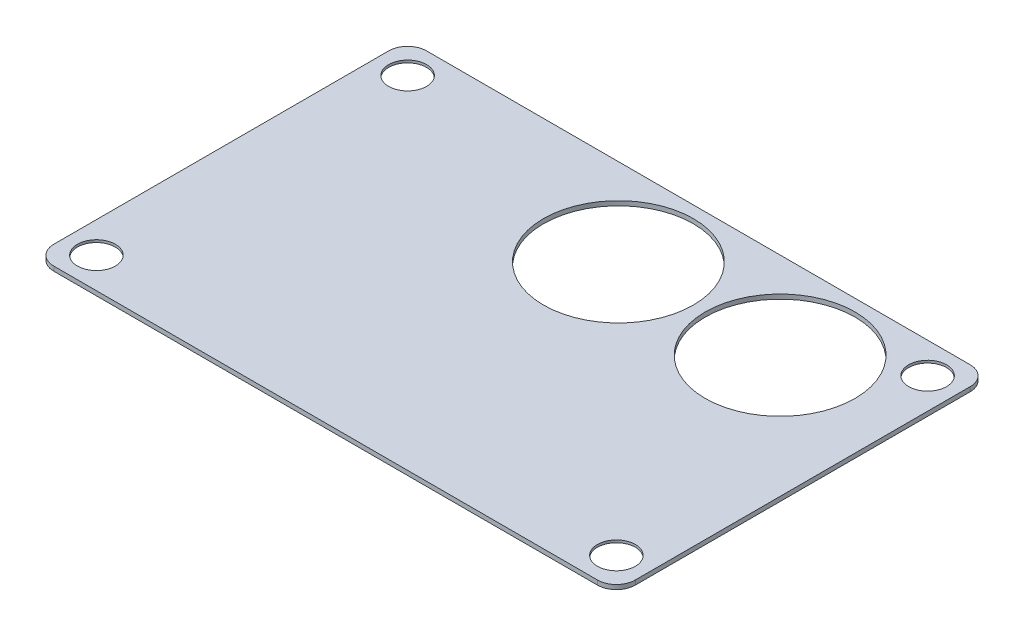
from build123d import *

# Parameters (mm, degrees)
SKETCH1_W               = 78
SKETCH1_H               = 50
PCB_DEPTH               = 0.6
CARD_EDGES_R            = 2.54
SKETCH4_R               = 2.54
MAGNET_HOLE_CUT_DEPTH   = 93.651821353
SKETCH8_R               = 3.33
STEEL_INLAY_CUT_DEPTH   = 0.266625
MIRROR2_COPY_1_SKETCH_R = 2.54
MIRROR2_COPY_1_DEPTH    = 93.651821353
MIRROR2_COPY_2_SKETCH_R = 3.33
MIRROR2_COPY_2_DEPTH    = 0.266625
SKETCH15_R              = 10.05
BATTERY_HOLES_DEPTH     = 93.651821353


with BuildPart() as part:
    # Sketch1 → pcb (new body)
    with BuildSketch(Plane(origin=(0, 0, 0), x_dir=(1, 0, 0), z_dir=(0, 1, 0))):
        with Locations((39, 25)):
            Rectangle(SKETCH1_W, SKETCH1_H)
    extrude(amount=PCB_DEPTH)

    # card edges
    card_edges_edges = [part.edges().sort_by_distance(p)[0] for p in [
        (0, 0.3, -50),
        (78, 0.3, -50),
        (78, 0.3, 0),
        (0, 0.3, 0),
    ]]
    fillet(card_edges_edges, radius=CARD_EDGES_R)

    # Sketch4 → magnet hole cut (cut, through all)
    with BuildSketch(Plane(origin=(0, 0.6, 0), x_dir=(1, 0, 0), z_dir=(0, 1, 0))):
        with Locations(Location((4.1275, 4.13, 0), (0, 0, 270))):
            Circle(SKETCH4_R)
    magnet_hole_cut = extrude(amount=-MAGNET_HOLE_CUT_DEPTH, mode=Mode.SUBTRACT)

    # Sketch8 → steel inlay cut (cut)
    with BuildSketch(Plane.XZ):
        with Locations(Location((4.1275, -4.13, 0), (0, 0, 270))):
            Circle(SKETCH8_R)
    steel_inlay_cut = extrude(amount=-STEEL_INLAY_CUT_DEPTH, mode=Mode.SUBTRACT)

    # Mirror1: magnet hole cut, steel inlay cut across plane
    add(magnet_hole_cut.mirror(Plane.XY.offset(-25)), mode=Mode.SUBTRACT)
    add(steel_inlay_cut.mirror(Plane.XY.offset(-25)), mode=Mode.SUBTRACT)

    # Mirror2: magnet hole cut, steel inlay cut across plane
    add(magnet_hole_cut.mirror(Plane(origin=(39, 0, 0), x_dir=(0, 0, 1), z_dir=(1, 0, 0))), mode=Mode.SUBTRACT)
    add(steel_inlay_cut.mirror(Plane(origin=(39, 0, 0), x_dir=(0, 0, 1), z_dir=(1, 0, 0))), mode=Mode.SUBTRACT)

    # Mirror2 copy 1 sketch → Mirror2 copy 1 (cut, through all)
    with BuildSketch(Plane(origin=(78, 0.6, -50), x_dir=(-1, 0, 0), z_dir=(0, 1, 0))):
        with Locations(Location((4.1275, 4.13, 0), (0, 0, 270))):
            Circle(MIRROR2_COPY_1_SKETCH_R)
    extrude(amount=-MIRROR2_COPY_1_DEPTH, mode=Mode.SUBTRACT)

    # Mirror2 copy 2 sketch → Mirror2 copy 2 (cut)
    with BuildSketch(Plane(origin=(78, 0, -50), x_dir=(-1, 0, 0), z_dir=(0, -1, 0))):
        with Locations(Location((4.1275, -4.13, 0), (0, 0, 270))):
            Circle(MIRROR2_COPY_2_SKETCH_R)
    extrude(amount=-MIRROR2_COPY_2_DEPTH, mode=Mode.SUBTRACT)

    # Sketch15 → battery_holes (cut, through all)
    with BuildSketch(Plane(origin=(0, 0.6, 0), x_dir=(1, 0, 0), z_dir=(0, 1, 0))):
        with Locations(Location((61.6, 38.3625, 0), (0, 0, 270))):
            Circle(SKETCH15_R)
        with Locations(Location((39.9125, 38.3625, 0), (0, 0, 270))):
            Circle(SKETCH15_R)
    extrude(amount=-BATTERY_HOLES_DEPTH, mode=Mode.SUBTRACT)


solid = part.part
